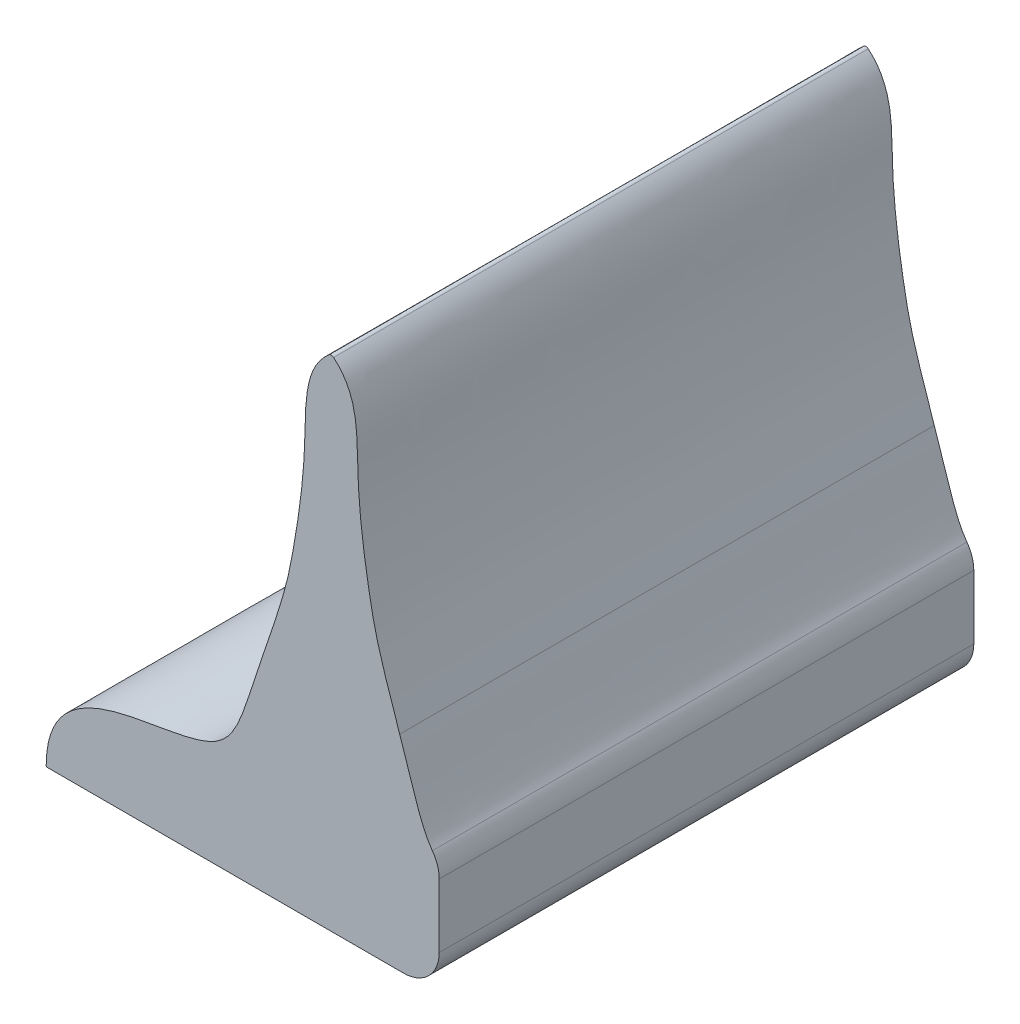
from build123d import *

# Parameters (mm, degrees)
EXTRUDE_1_DEPTH     = 30
SKETCH_2_W          = 50.362012325
SKETCH_2_H          = 20.569427205
CUT_EXTRUDE_1_DEPTH = 30
FILLET_1_R          = 2
FILLET_2_R          = 0.2
FILLET_3_R          = 0.05


with BuildPart() as part:
    # 草图1 → 凸台-拉伸1 (new body)
    with BuildSketch(Plane.XY):
        with BuildLine():
            Line((-16, 0), (16, 0))
            add(Edge.make_bspline(
                [(3.839287923, 11.506222932), (4.93905782, 8.31834192), (5.60973107, 3.774130513), (16.015287623, 5.725331765), (16, 0)],
                knots=[0, 0, 0, 0, 0.346447494, 1, 1, 1, 1], degree=3))
            add(Edge.make_bspline(
                [(3.839287923, 11.506222932), (2.661546976, 14.920117068), (2.26787354, 16.507870906), (1.244234488, 22.89042522), (1.600315557, 26.835685967), (0, 28.064804979)],
                knots=[0, 0, 0, 0, 0.351320855, 0.674109807, 1, 1, 1, 1], degree=3))
            add(Edge.make_bspline(
                [(-3.839287923, 11.506222932), (-2.661546976, 14.920117068), (-2.26787354, 16.507870906), (-1.244234488, 22.89042522), (-1.600315557, 26.835685967), (0, 28.064804979)],
                knots=[0, 0, 0, 0, 0.351320855, 0.674109807, 1, 1, 1, 1], degree=3))
            add(Edge.make_bspline(
                [(-3.839287923, 11.506222932), (-4.93905782, 8.31834192), (-5.60973107, 3.774130513), (-16.015287623, 5.725331765), (-16, 0)],
                knots=[0, 0, 0, 0, 0.346447494, 1, 1, 1, 1], degree=3))
        make_face()
    extrude(amount=EXTRUDE_1_DEPTH)

    # 草图2 → 切除-拉伸1 (cut)
    with BuildSketch(Plane.XY.offset(30)):
        with Locations((31.23663348, 4.229005075)):
            Rectangle(SKETCH_2_W, SKETCH_2_H)
    extrude(amount=-CUT_EXTRUDE_1_DEPTH, mode=Mode.SUBTRACT)

    # 圆角1
    fillet_1_edges = [part.edges().sort_by_distance(p)[0] for p in [
        (6.055627317, 0, 15),
        (6.055627317, 6.323254919, 15),
    ]]
    fillet(fillet_1_edges, radius=FILLET_1_R)

    # 圆角2
    fillet_2_edges = [part.edges().sort_by_distance(p)[0] for p in [
        (0, 28.064804979, 15),
    ]]
    fillet(fillet_2_edges, radius=FILLET_2_R)

    # 圆角3
    fillet_3_edges = [part.edges().sort_by_distance(p)[0] for p in [
        (-16, 0, 15),
    ]]
    fillet(fillet_3_edges, radius=FILLET_3_R)


solid = part.part
